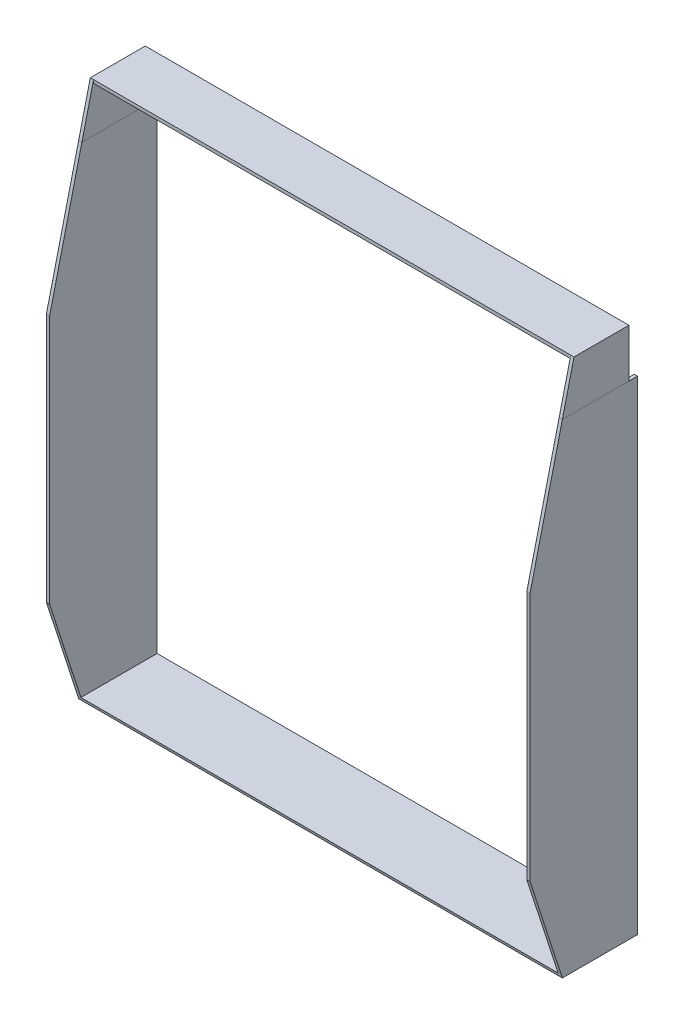
from build123d import *

# Parameters (mm, degrees)
BOSS_EXTRU_1_DEPTH      = 100
ENL_V_MAT_EXTRU_1_DEPTH = 496
BOSS_EXTRU_8_DEPTH      = 3
BOSS_EXTRU_9_DEPTH      = 3
ESQUISSE11_W            = 51.182692308
ESQUISSE11_H            = 3
BOSS_EXTRU_10_DEPTH     = 444.3


with BuildPart() as part:
    # Esquisse1 → Boss.-Extru.1 (new body)
    with BuildSketch(Plane.XY):
        Polygon((-447.3, -5.25), (-447.3, -449.55), (-3, -449.55), (-3, -5.25), (-3, -2.25), (0, -2.25), (0, -452.55), (-450.3, -452.55), (-450.3, -2.25), (-447.3, -2.25), align=None)
    extrude(amount=BOSS_EXTRU_1_DEPTH)

    # Esquisse2 → Enlèv. mat.-Extru.1 (cut)
    with BuildSketch(Plane(origin=(0, 0, 0), x_dir=(0, 0, -1), z_dir=(1, 0, 0))):
        Polygon((-70, -452.55), (-100, -359.902941176), (-100, -452.55), align=None)
        Polygon((-100, -127.05), (-70, -2.25), (-100, -2.25), align=None)
    extrude(amount=-ENL_V_MAT_EXTRU_1_DEPTH, mode=Mode.SUBTRACT)


with BuildPart() as body_2:
    # Esquisse9 → Boss.-Extru.8 (new body)
    with BuildSketch(Plane.ZY.offset(450.3)):
        Polygon((8, -2.25), (70, -2.25), (59.182692308, 42.75), (8, 42.75), align=None)
    extrude(amount=-BOSS_EXTRU_8_DEPTH)



with BuildPart() as body_3:
    # Esquisse10 → Boss.-Extru.9 (new body)
    with BuildSketch(Plane(origin=(0, 0, 0), x_dir=(0, 0, -1), z_dir=(1, 0, 0))):
        Polygon((-8, -2.25), (-70, -2.25), (-59.182692308, 42.75), (-8, 42.75), align=None)
    extrude(amount=-BOSS_EXTRU_9_DEPTH)


with BuildPart() as body_2_1:
    add(body_2.part)

    add(body_3.part)  # Boss.-Extru.10 merges body 3
    # Esquisse11 → Boss.-Extru.10 (add)
    with BuildSketch(Plane.ZY.offset(3)):
        with Locations((33.591346154, 41.25)):
            Rectangle(ESQUISSE11_W, ESQUISSE11_H)
    extrude(amount=BOSS_EXTRU_10_DEPTH)


solid = Compound([part.part, body_2_1.part])
